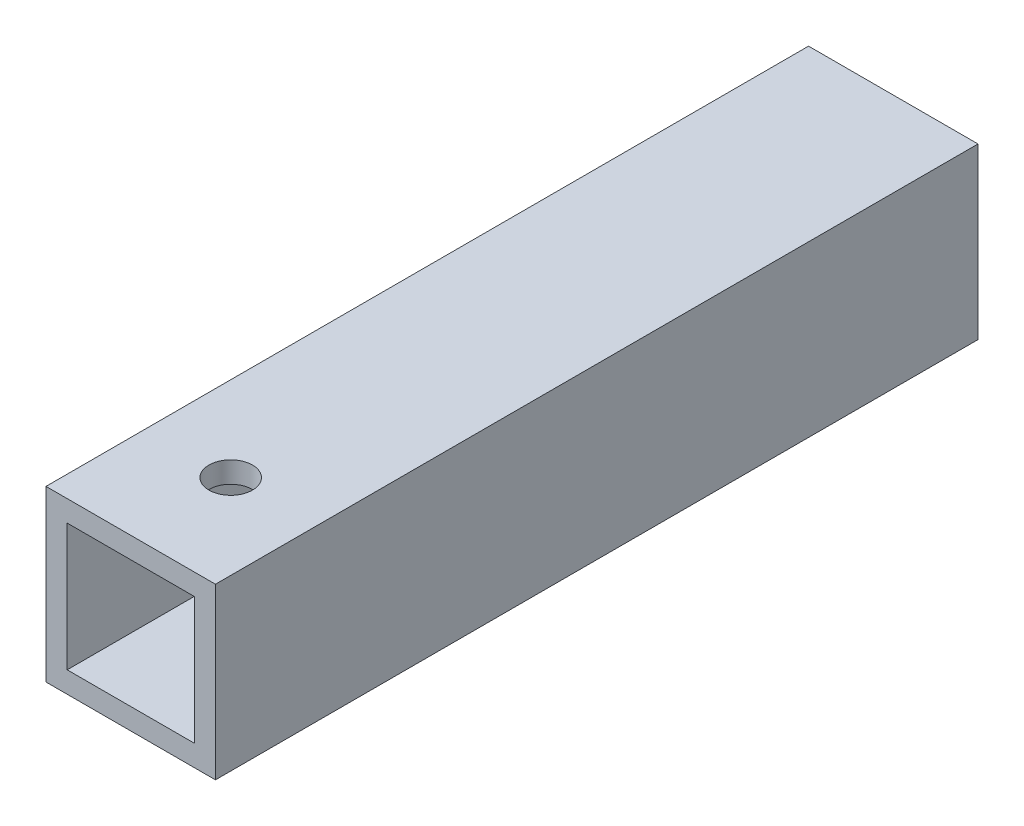
from build123d import *

# Parameters (mm, degrees)
SKETCH1_W           = 25.4
SKETCH1_H           = 25.4
BOSS_EXTRUDE1_DEPTH = 114.3
SKETCH2_W           = 19.05
SKETCH2_H           = 19.05
CUT_EXTRUDE1_DEPTH  = 116.702506455
SKETCH3_R           = 3.2639
CUT_EXTRUDE2_DEPTH  = 118.774954893


with BuildPart() as part:
    # Sketch1 → Boss-Extrude1 (new body)
    with BuildSketch(Plane.XY):
        Rectangle(SKETCH1_W, SKETCH1_H)
    extrude(amount=BOSS_EXTRUDE1_DEPTH)

    # Sketch2 → Cut-Extrude1 (cut, through all)
    with BuildSketch(Plane.XY):
        Rectangle(SKETCH2_W, SKETCH2_H)
    extrude(amount=CUT_EXTRUDE1_DEPTH, mode=Mode.SUBTRACT)

    # Sketch3 → Cut-Extrude2 (cut, through all)
    with BuildSketch(Plane(origin=(0, 12.7, 0), x_dir=(1, 0, 0), z_dir=(0, 1, 0))):
        with Locations(Location((0, -99.314, 0), (0, 0, 180))):
            Circle(SKETCH3_R)
    extrude(amount=-CUT_EXTRUDE2_DEPTH, mode=Mode.SUBTRACT)


solid = part.part
